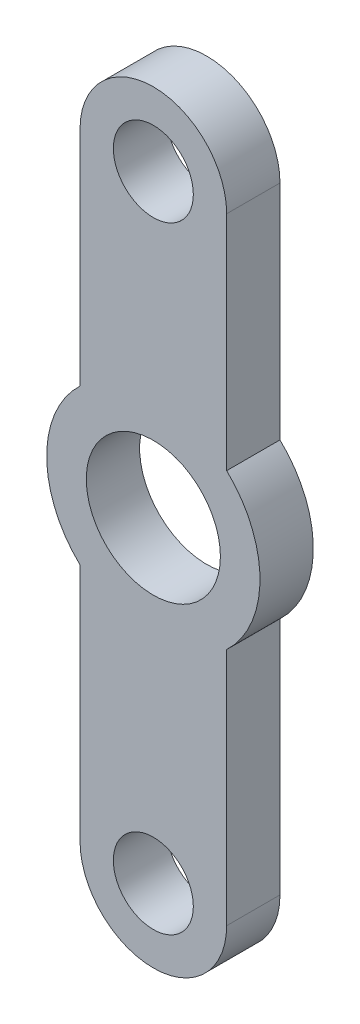
from build123d import *

# Parameters (mm, degrees)
SKETCH_1_R      = 3
SKETCH_1_R_2    = 5.03
EXTRUDE_1_DEPTH = 4


with BuildPart() as part:
    # 草图1 → 凸台-拉伸1 (new body)
    with BuildSketch(Plane.XY):
        with BuildLine():
            Line((5.5, 22.5), (5.5, 5.809475019))
            ThreePointArc((5.5, 5.809475019), (8, 0), (5.5, -5.809475019))
            Line((5.5, -5.809475019), (5.5, -23.75))
            ThreePointArc((5.5, -23.75), (0, -29.25), (-5.5, -23.75))
            Line((-5.5, -23.75), (-5.5, -5.809475019))
            ThreePointArc((-5.5, -5.809475019), (-8, 0), (-5.5, 5.809475019))
            Line((-5.5, 5.809475019), (-5.5, 22.5))
            ThreePointArc((-5.5, 22.5), (0, 28), (5.5, 22.5))
        make_face()
        with Locations((0, 22.5)):
            Circle(SKETCH_1_R, mode=Mode.SUBTRACT)
        with Locations((0, -23.75)):
            Circle(SKETCH_1_R, mode=Mode.SUBTRACT)
        Circle(SKETCH_1_R_2, mode=Mode.SUBTRACT)
    extrude(amount=EXTRUDE_1_DEPTH)


solid = part.part
